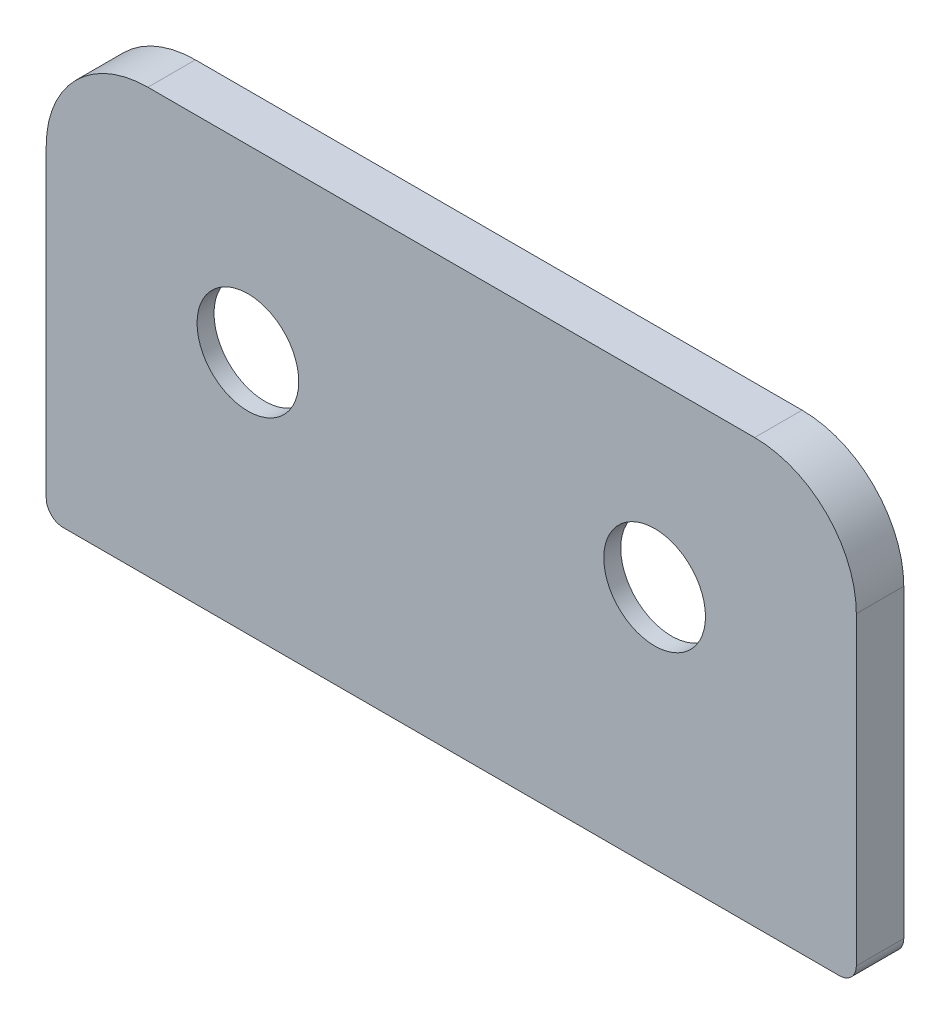
from build123d import *

# Parameters (mm, degrees)
SKICA1_W                 = 1.7
SKICA1_H                 = 7.8
SKICA1_R                 = 1.5
P_IDAT_VYSUNUT_M3_DEPTH  = 1.4
SKICA3_R                 = 3.986213299
ODEBRAT_VYSUNUT_M1_DEPTH = 0.9
SKICA7_W                 = 1.7
SKICA7_H                 = 7.8
P_IDAT_VYSUNUT_M5_DEPTH  = 1.4


with BuildPart() as part:
    # Skica1 → Přidat vysunutím3 (new body)
    with BuildSketch(Plane.XY):
        with BuildLine():
            Line((-11.45, -6.25), (11.45, -6.25))
            ThreePointArc((11.45, -6.25), (11.803553391, -6.103553391), (11.95, -5.75))
            Line((11.95, -5.75), (11.95, 3.25))
            ThreePointArc((11.95, 3.25), (11.071320344, 5.371320344), (8.95, 6.25))
            Line((8.95, 6.25), (-8.95, 6.25))
            ThreePointArc((-8.95, 6.25), (-11.071320344, 5.371320344), (-11.95, 3.25))
            Line((-11.95, 3.25), (-11.95, -5.75))
            ThreePointArc((-11.95, -5.75), (-11.803553391, -6.103553391), (-11.45, -6.25))
        make_face()
        Rectangle(SKICA1_W, SKICA1_H, mode=Mode.SUBTRACT)
        with Locations((-6, 0.95)):
            Circle(SKICA1_R, mode=Mode.SUBTRACT)
        with Locations((6, 0.95)):
            Circle(SKICA1_R, mode=Mode.SUBTRACT)
    extrude(amount=P_IDAT_VYSUNUT_M3_DEPTH)

    # Skica3 → Odebrat vysunutím1 (cut)
    with BuildSketch(Plane(origin=(0, 0, 0), x_dir=(-1, 0, 0), z_dir=(0, 0, -1))):
        with Locations((-6, 0.95)):
            Circle(SKICA3_R)
        with Locations((6, 0.95)):
            Circle(SKICA3_R)
    extrude(amount=-ODEBRAT_VYSUNUT_M1_DEPTH, mode=Mode.SUBTRACT)

    # Skica7 → Přidat vysunutím5 (add)
    with BuildSketch(Plane(origin=(0, 0, 0), x_dir=(-1, 0, 0), z_dir=(0, 0, -1))):
        Rectangle(SKICA7_W, SKICA7_H)
    extrude(amount=-P_IDAT_VYSUNUT_M5_DEPTH)


solid = part.part
